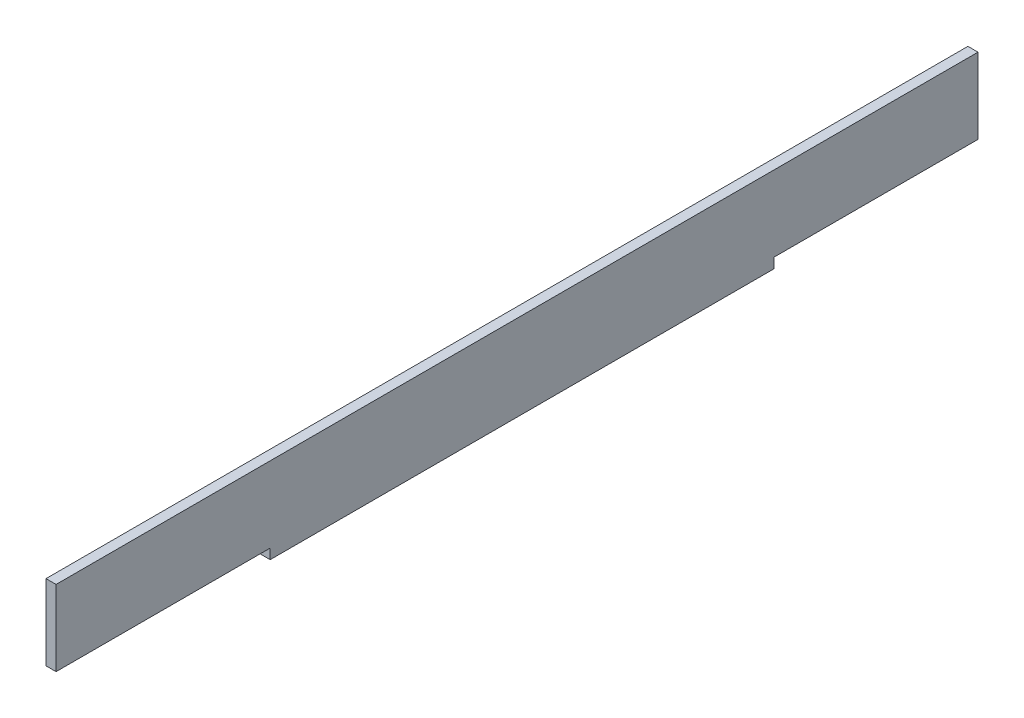
from build123d import *

# Parameters (mm, degrees)
BOSS_EXTRUDE1_DEPTH = 4


with BuildPart() as part:
    # Sketch1 → Boss-Extrude1 (new body)
    with BuildSketch(Plane(origin=(0, 0, 0), x_dir=(0, 0, -1), z_dir=(1, 0, 0))):
        Polygon((-117.967275659, -11.463619022), (82.032724341, -11.463619022), (82.032724341, -7.463619022), (163.032724341, -7.463619022), (163.032724341, 22.536380978), (82.032724341, 22.536380978), (-117.967275659, 22.536380978), (-202.967275659, 22.536380978), (-202.967275659, -7.463619022), (-117.967275659, -7.463619022), align=None)
    extrude(amount=BOSS_EXTRUDE1_DEPTH)


solid = part.part
